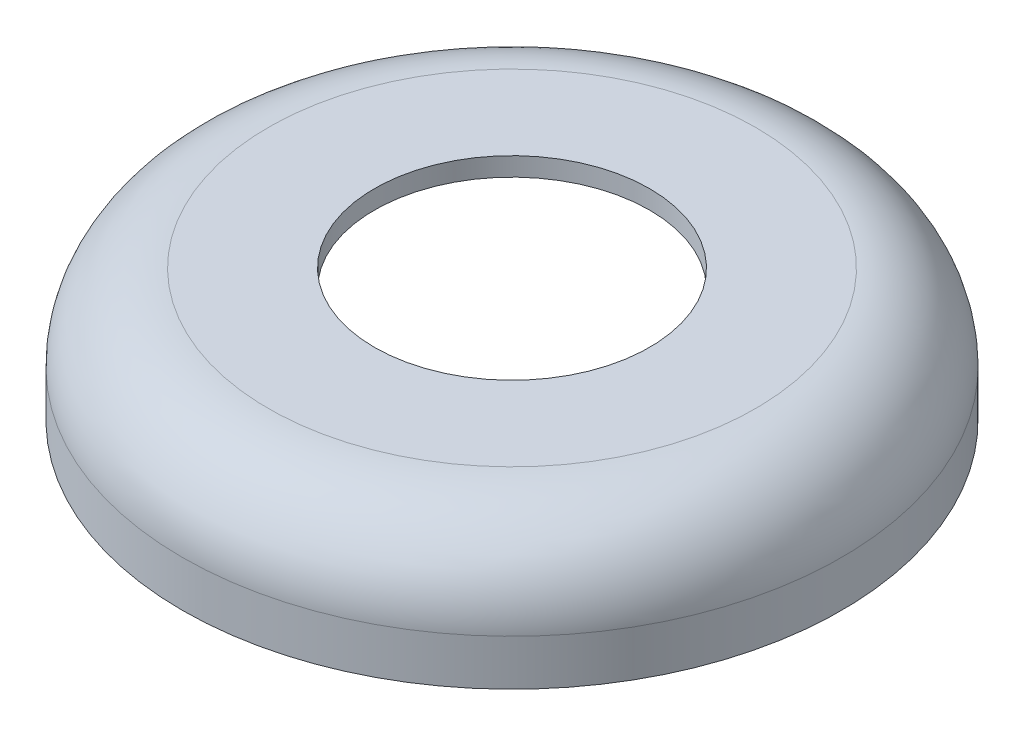
from build123d import *

# Parameters (mm, degrees)
SHELL1_T           = -0.65
SKETCH2_R          = 4.8
CUT_EXTRUDE1_DEPTH = 10


with BuildPart() as part:
    # Sketch1 → Revolve1 (revolve)
    with BuildSketch(Plane.XY, mode=Mode.PRIVATE) as revolve1_sk:
        with BuildLine():
            Line((0, 0), (11.5, 0))
            Line((11.5, 0), (11.5, 1.6))
            ThreePointArc((11.5, 1.6), (10.621320344, 3.721320344), (8.5, 4.6))
            Line((8.5, 4.6), (0, 4.6))
            Line((0, 4.6), (0, 0))
        make_face()
    revolve(revolve1_sk.sketch.rotate(Axis((0, 0, 0), (0, 1, 0)), 90), axis=Axis((0, 0, 0), (0, 1, 0)))

    # Shell1
    shell1_openings = [part.faces().sort_by_distance(p)[0] for p in [
        (0, 0, 0),
    ]]
    offset(amount=SHELL1_T, openings=shell1_openings, kind=Kind.INTERSECTION)

    # Sketch2 → Cut-Extrude1 (cut)
    with BuildSketch(Plane(origin=(0, 4.6, 0), x_dir=(1, 0, 0), z_dir=(0, 1, 0))):
        with Locations(Location((0, 0, 0), (0, 0, 270))):
            Circle(SKETCH2_R)
    extrude(amount=-CUT_EXTRUDE1_DEPTH, mode=Mode.SUBTRACT)


solid = part.part
